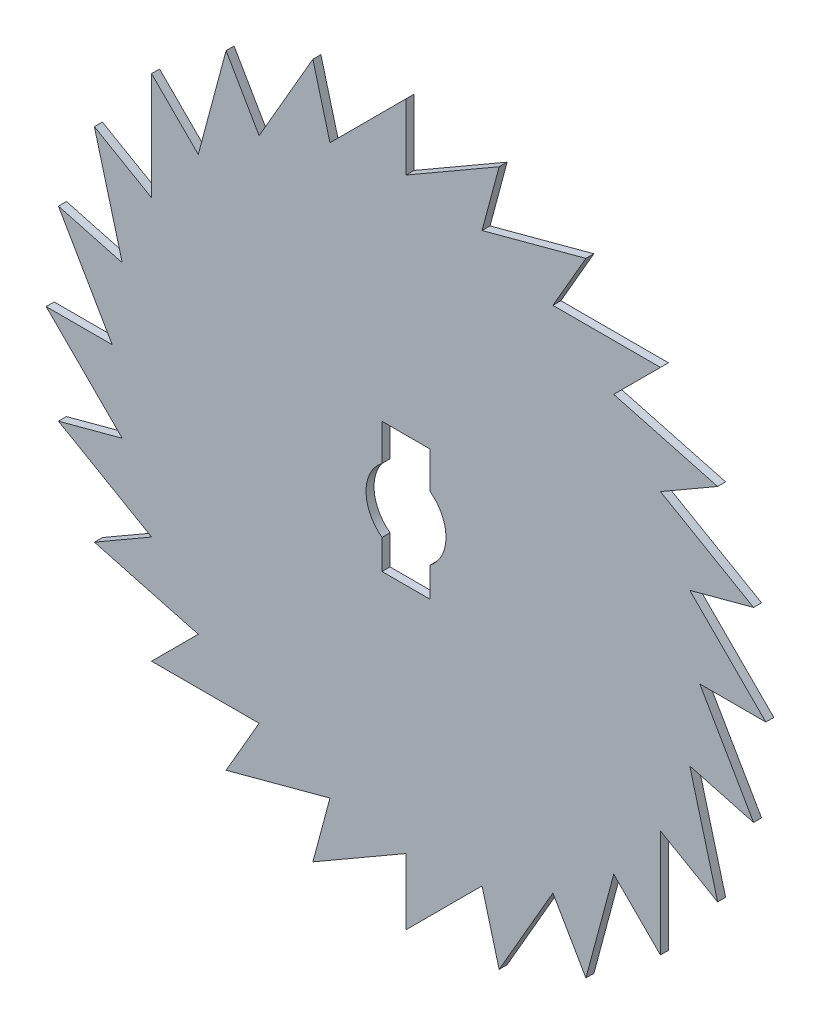
from build123d import *

# Parameters (mm, degrees)
SKETCH1_R           = 5
BOSS_EXTRUDE1_DEPTH = 1
SKETCH3_W           = 6
SKETCH3_H           = 16.269445872
CUT_EXTRUDE1_DEPTH  = 10


with BuildPart() as part:
    # Sketch1 → Boss-Extrude1 (new body)
    with BuildSketch(Plane.XY):
        Polygon((0, 45), (0, 36.742346142), (11.64685703, 43.466662183), (9.509618943, 35.490381057), (22.5, 38.97114317), (18.371173071, 31.819805153), (31.819805153, 31.819805153), (25.980762114, 25.980762114), (38.97114317, 22.5), (31.819805153, 18.371173071), (43.466662183, 11.64685703), (35.490381057, 9.509618943), (45, 0), (36.742346142, 0), (43.466662183, -11.64685703), (35.490381057, -9.509618943), (38.97114317, -22.5), (31.819805153, -18.371173071), (31.819805153, -31.819805153), (25.980762114, -25.980762114), (22.5, -38.97114317), (18.371173071, -31.819805153), (11.64685703, -43.466662183), (9.509618943, -35.490381057), (0, -45), (0, -36.742346142), (-11.64685703, -43.466662183), (-9.509618943, -35.490381057), (-22.5, -38.97114317), (-18.371173071, -31.819805153), (-31.819805153, -31.819805153), (-25.980762114, -25.980762114), (-38.97114317, -22.5), (-31.819805153, -18.371173071), (-43.466662183, -11.64685703), (-35.490381057, -9.509618943), (-45, 0), (-36.742346142, 0), (-43.466662183, 11.64685703), (-35.490381057, 9.509618943), (-38.97114317, 22.5), (-31.819805153, 18.371173071), (-31.819805153, 31.819805153), (-25.980762114, 25.980762114), (-22.5, 38.97114317), (-18.371173071, 31.819805153), (-11.64685703, 43.466662183), (-9.509618943, 35.490381057), align=None)
        Circle(SKETCH1_R, mode=Mode.SUBTRACT)
    extrude(amount=BOSS_EXTRUDE1_DEPTH)

    # Sketch3 → Cut-Extrude1 (cut)
    with BuildSketch(Plane.XY.offset(1)):
        with Locations((0, 0.439123073)):
            Rectangle(SKETCH3_W, SKETCH3_H)
    extrude(amount=-CUT_EXTRUDE1_DEPTH, mode=Mode.SUBTRACT)


solid = part.part
